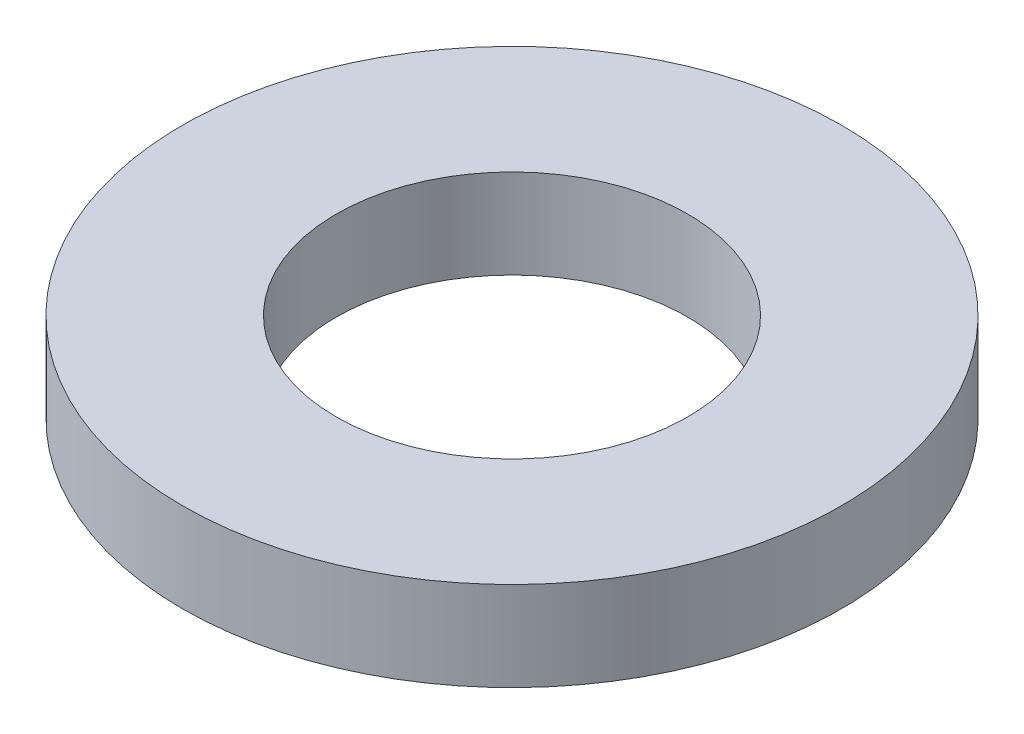
from build123d import *

# Parameters (mm, degrees)
SKETCH1_R           = 11.90625
SKETCH1_R_2         = 6.35
BOSS_EXTRUDE1_DEPTH = 3.2258


with BuildPart() as part:
    # Sketch1 → Boss-Extrude1 (new body)
    with BuildSketch(Plane(origin=(0, 0, 0), x_dir=(1, 0, 0), z_dir=(0, 1, 0))):
        with Locations(Location((0, 0, 0), (0, 0, 270))):
            Circle(SKETCH1_R)
        with Locations(Location((0, 0, 0), (0, 0, 270))):
            Circle(SKETCH1_R_2, mode=Mode.SUBTRACT)
    extrude(amount=BOSS_EXTRUDE1_DEPTH)


solid = part.part
